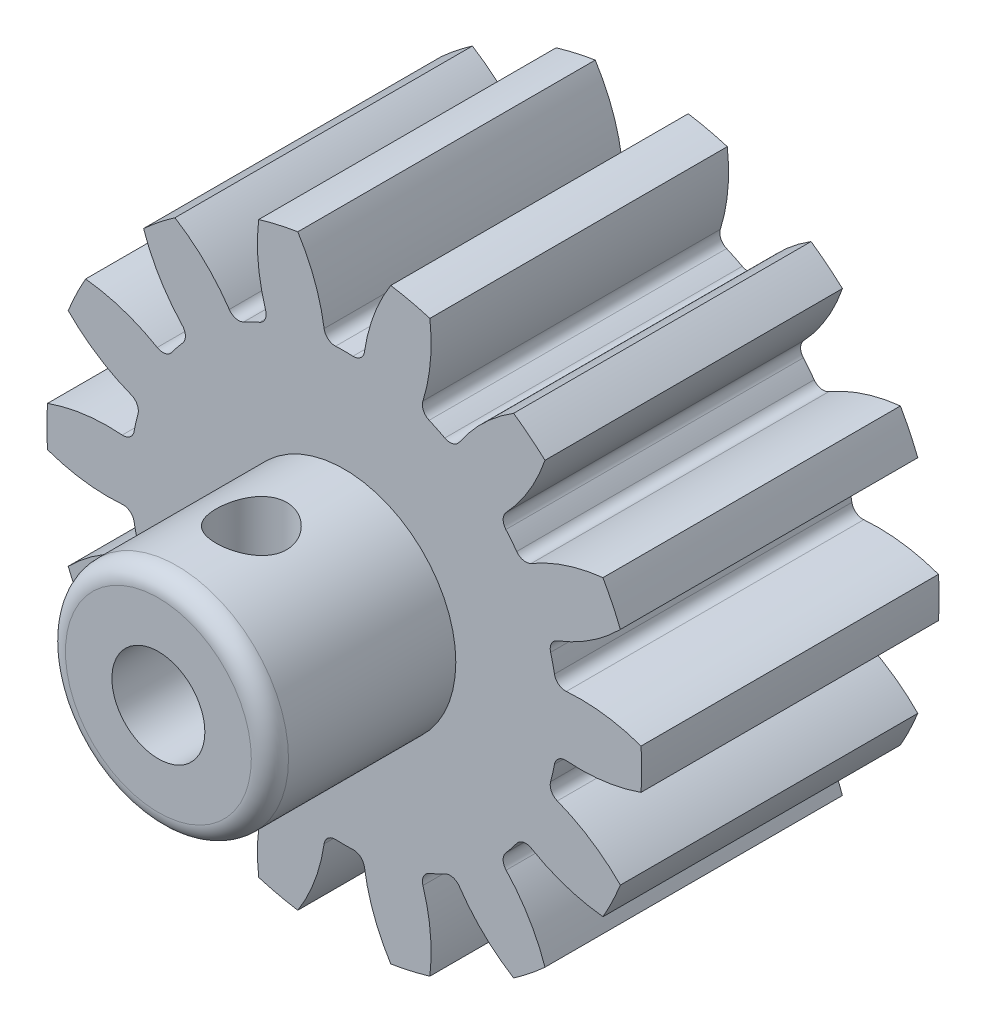
from build123d import *

# Parameters (mm, degrees)
IZIM1_R                        = 16
Y_KSEKLIK_EKSTR_ZYON1_DEPTH    = 8
KES_EKSTR_ZYON1_DEPTH          = 16
RADYUS1_R                      = 0.6
DAIRESEL_KAPLAMA1_COUNT        = 14
RADYUS1_OF_DAIRESEL_KAPLAMA1_R = 0.6
SKETCH1_R                      = 6
SKETCH1_R_2                    = 2.5
BOSS_EXTRUDE1_DEPTH            = 10
CUT_EXTRUDE3_DEPTH             = 29.805394861
CUT_EXTRUDE3_DEPTH_BACK        = 29.805394861
SKETCH6_R                      = 1.9
FILLET1_R                      = 1
CUT_EXTRUDE4_START             = -37
SKETCH7_R                      = 2.5
CUT_EXTRUDE4_DEPTH             = 37


with BuildPart() as part:
    # Çizim1 → Yükseklik-Ekstrüzyon1 (new, symmetric)
    with BuildSketch(Plane.XY):
        Circle(IZIM1_R)
    extrude(amount=Y_KSEKLIK_EKSTR_ZYON1_DEPTH, both=True)

    # Çizim2 → Kes-Ekstrüzyon1 (cut)
    with BuildSketch(Plane.XY.offset(8)):
        with BuildLine():
            ThreePointArc((-3.149616474, 16.705685142), (-1.693274117, 14.239025291), (-1.020653849, 11.454617659))
            ThreePointArc((-1.020653849, 11.454617659), (0, 11.5), (1.020653849, 11.454617659))
            ThreePointArc((1.020653849, 11.454617659), (1.693274117, 14.239025291), (3.149616474, 16.705685142))
            ThreePointArc((3.149616474, 16.705685142), (0, 17), (-3.149616474, 16.705685142))
        make_face()
    kes_ekstr_zyon1 = extrude(amount=-KES_EKSTR_ZYON1_DEPTH, mode=Mode.SUBTRACT)

    # Radyus1
    radyus1_edges = [part.edges().sort_by_distance(p)[0] for p in [
        (-1.020653849, 11.454617659, 0),
        (1.020653849, 11.454617659, 0),
    ]]
    fillet(radyus1_edges, radius=RADYUS1_R)

    # Dairesel Kaplama1: Kes-Ekstrüzyon1 ×14 about axis
    dairesel_kaplama1_axis = Axis((0, 0, 0), (0, 0, 1))
    for i in range(1, DAIRESEL_KAPLAMA1_COUNT):
        add(kes_ekstr_zyon1.rotate(dairesel_kaplama1_axis, i * 360 / DAIRESEL_KAPLAMA1_COUNT), mode=Mode.SUBTRACT)

    # Radyus1 of Dairesel Kaplama1
    radyus1_of_dairesel_kaplama1_edges = [part.edges().sort_by_distance(p)[0] for p in [
        (-5.889549683, 9.877408796, 0),
        (-4.050394997, 10.763099013, 0),
        (-9.591947972, 6.343857983, 0),
        (-8.319213439, 7.939816607, 0),
        (-11.394543327, 1.553828293, 0),
        (-10.940309632, 3.543956146, 0),
        (-10.940309632, -3.543956146, 0),
        (-11.394543327, -1.553828293, 0),
        (-8.319213439, -7.939816607, 0),
        (-9.591947972, -6.343857983, 0),
        (-4.050394997, -10.763099013, 0),
        (-5.889549683, -9.877408796, 0),
        (1.020653849, -11.454617659, 0),
        (-1.020653849, -11.454617659, 0),
        (5.889549683, -9.877408796, 0),
        (4.050394997, -10.763099013, 0),
        (9.591947972, -6.343857983, 0),
        (8.319213439, -7.939816607, 0),
        (11.394543327, -1.553828293, 0),
        (10.940309632, -3.543956146, 0),
        (10.940309632, 3.543956146, 0),
        (11.394543327, 1.553828293, 0),
        (8.319213439, 7.939816607, 0),
        (9.591947972, 6.343857983, 0),
        (4.050394997, 10.763099013, 0),
        (5.889549683, 9.877408796, 0),
    ]]
    fillet(radyus1_of_dairesel_kaplama1_edges, radius=RADYUS1_OF_DAIRESEL_KAPLAMA1_R)

    # Sketch1 → Boss-Extrude1 (add)
    with BuildSketch(Plane.XY.offset(8)):
        Circle(SKETCH1_R)
        Circle(SKETCH1_R_2, mode=Mode.SUBTRACT)
    extrude(amount=BOSS_EXTRUDE1_DEPTH)

    # Sketch6 → Cut-Extrude3 (cut, two sides: drawn at the far end of the back side and taken through both)
    with BuildSketch(Plane(origin=(0, 0, 0), x_dir=(1, 0, 0), z_dir=(0, 1, 0)).offset(-CUT_EXTRUDE3_DEPTH_BACK)):
        with Locations(Location((0, -13, 0), (0, 0, 270))):
            Circle(SKETCH6_R)
    extrude(amount=CUT_EXTRUDE3_DEPTH + CUT_EXTRUDE3_DEPTH_BACK, mode=Mode.SUBTRACT)

    # Fillet1
    fillet1_edges = [part.edges().sort_by_distance(p)[0] for p in [
        (-6, 0, 18),
    ]]
    fillet(fillet1_edges, radius=FILLET1_R)

    # Sketch7 → Cut-Extrude4 (cut)
    with BuildSketch(Plane.XY.offset(18).offset(CUT_EXTRUDE4_START)):
        Circle(SKETCH7_R)
    extrude(amount=CUT_EXTRUDE4_DEPTH, mode=Mode.SUBTRACT)


solid = part.part
